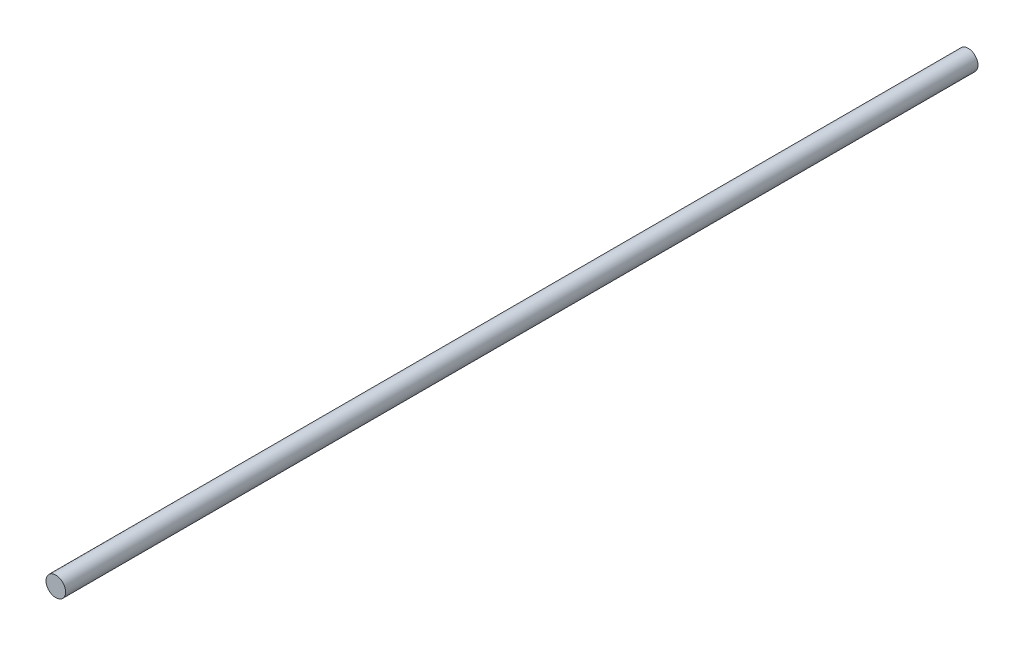
from build123d import *

# Parameters (mm, degrees)
SKETCH1_R           = 6.35
BOSS_EXTRUDE1_DEPTH = 295.275


with BuildPart() as part:
    # Sketch1 → Boss-Extrude1 (new, symmetric)
    with BuildSketch(Plane.XY):
        Circle(SKETCH1_R)
    extrude(amount=BOSS_EXTRUDE1_DEPTH, both=True)


solid = part.part
